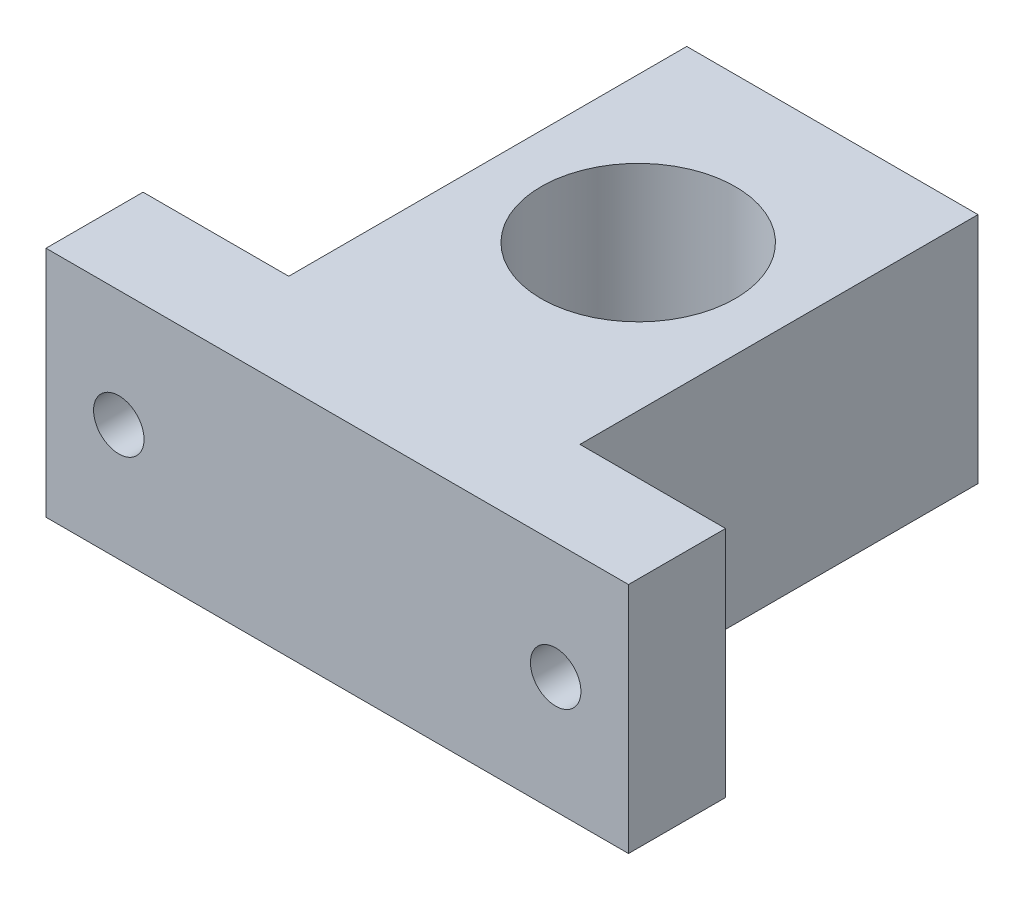
from build123d import *

# Parameters (mm, degrees)
SKETCH_1_R          = 10
EXTRUDE_1_DEPTH     = 24
SKETCH_2_R          = 2.6
CUT_EXTRUDE_1_DEPTH = 24


with BuildPart() as part:
    # 草图1 → 凸台-拉伸1 (new body)
    with BuildSketch(Plane(origin=(0, 0, 0), x_dir=(1, 0, 0), z_dir=(0, 1, 0))):
        Polygon((30, 0), (-30, 0), (-30, 10), (-15, 10), (-15, 51), (15, 51), (15, 10), (30, 10), align=None)
        with Locations(Location((0, 31, 0), (0, 0, 270))):
            Circle(SKETCH_1_R, mode=Mode.SUBTRACT)
    extrude(amount=EXTRUDE_1_DEPTH)

    # 草图2 → 切除-拉伸1 (cut)
    with BuildSketch(Plane(origin=(0, 0, -10), x_dir=(-1, 0, 0), z_dir=(0, 0, -1))):
        with Locations((-22.5, 12)):
            Circle(SKETCH_2_R)
        with Locations((22.5, 12)):
            Circle(SKETCH_2_R)
    extrude(amount=-CUT_EXTRUDE_1_DEPTH, mode=Mode.SUBTRACT)


solid = part.part
